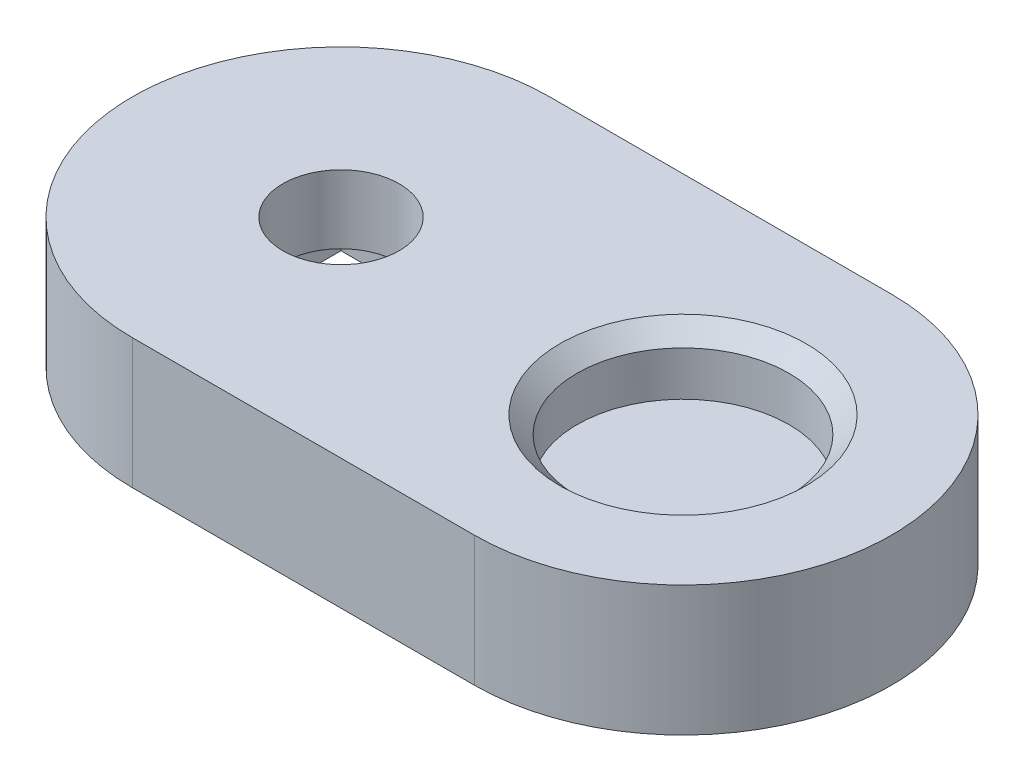
from build123d import *

# Parameters (mm, degrees)
SKETCH1_R           = 3.1
SKETCH1_W           = 5.9
SKETCH1_H           = 5.9
BOSS_EXTRUDE1_DEPTH = 3.8
SKETCH2_W           = 5.9
SKETCH2_H           = 5.9
SKETCH2_R           = 1.7
BOSS_EXTRUDE2_DEPTH = 2
SKETCH3_R           = 3.1
BOSS_EXTRUDE3_DEPTH = 2
CHAMFER1_SIZE       = 0.5


with BuildPart() as part:
    # Sketch1 → Boss-Extrude1 (new body)
    with BuildSketch(Plane(origin=(0, 0, 0), x_dir=(1, 0, 0), z_dir=(0, 1, 0))):
        with BuildLine():
            Line((-5, 6.1), (5, 6.1))
            ThreePointArc((5, 6.1), (11.1, 0), (5, -6.1))
            Line((5, -6.1), (-5, -6.1))
            ThreePointArc((-5, -6.1), (-11.1, 0), (-5, 6.1))
        make_face()
        with Locations(Location((5, 0, 0), (0, 0, 90))):
            Circle(SKETCH1_R, mode=Mode.SUBTRACT)
        with Locations((-5, 0)):
            Rectangle(SKETCH1_W, SKETCH1_H, mode=Mode.SUBTRACT)
    extrude(amount=BOSS_EXTRUDE1_DEPTH)

    # Sketch2 → Boss-Extrude2 (add)
    with BuildSketch(Plane(origin=(0, 3.8, 0), x_dir=(1, 0, 0), z_dir=(0, 1, 0))):
        with Locations((-5, 0)):
            Rectangle(SKETCH2_W, SKETCH2_H)
        with Locations(Location((-5, 0, 0), (0, 0, 270))):
            Circle(SKETCH2_R, mode=Mode.SUBTRACT)
    extrude(amount=-BOSS_EXTRUDE2_DEPTH)

    # Sketch3 → Boss-Extrude3 (add)
    with BuildSketch(Plane.XZ):
        with Locations(Location((5, 0, 0), (0, 0, 270))):
            Circle(SKETCH3_R)
    extrude(amount=-BOSS_EXTRUDE3_DEPTH)

    # Chamfer1
    chamfer1_edges = [part.edges().sort_by_distance(p)[0] for p in [
        (5, 3.8, 3.1),
    ]]
    chamfer(chamfer1_edges, length=CHAMFER1_SIZE)


solid = part.part
